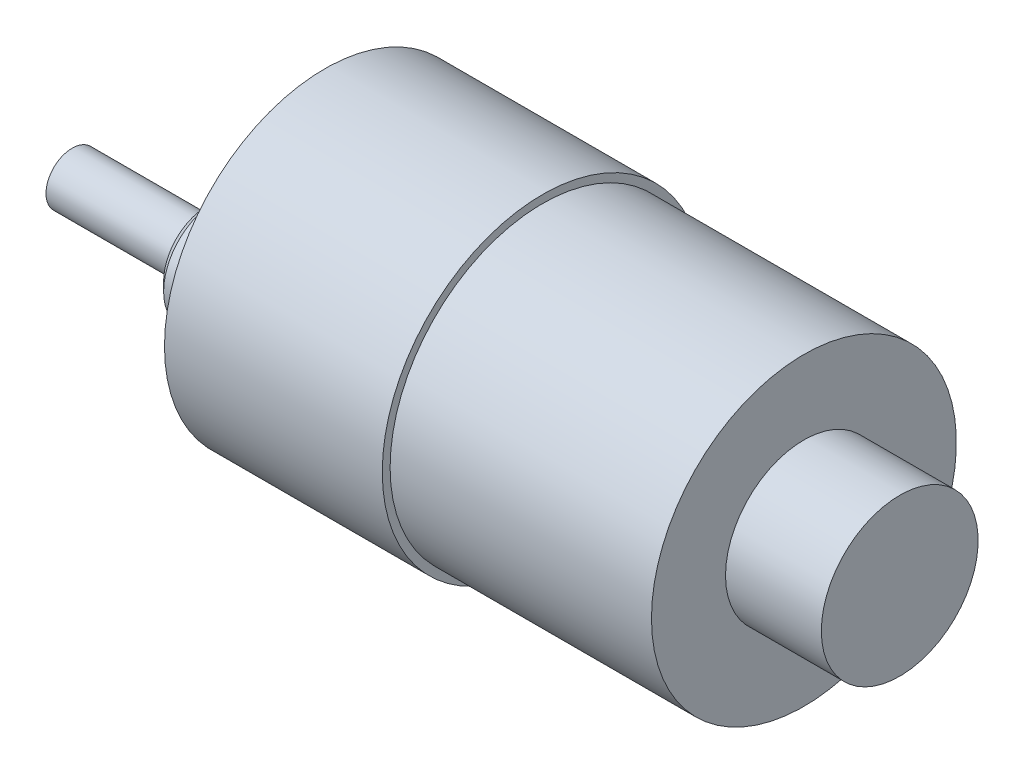
from build123d import *

# Parameters (mm, degrees)
ESQUISSE3_W                                   = 15.5
ESQUISSE3_H                                   = 3
ESQUISSE3_W_2                                 = 6.5
ESQUISSE3_H_2                                 = 6
CHANFREIN1_SIZE                               = 1
ENL_V_MAT_EXTRU_1_DEPTH                       = 82.278041315
ENL_V_MAT_EXTRU_1_DEPTH_BACK                  = 12
TROU_POUR_TARAUDAGE_POUR_TROU_TARAUD_M3_D     = 2.5
TROU_POUR_TARAUDAGE_POUR_TROU_TARAUD_M3_DEPTH = 15
TROU_POUR_TARAUDAGE_POUR_TROU_TARAUD_M3_TIP   = 0.751075774
ESQUISSE9_W                                   = 11
ESQUISSE9_H                                   = 9


with BuildPart() as part:
    # Esquisse1 → Révolution10 (revolve)
    with BuildSketch(Plane.XY, mode=Mode.PRIVATE) as r_volution10_sk:
        Polygon((0, 6), (0, 0), (12.5, 0), (55, 0), (55, 17.5), (25, 17.5), (25, 18.4), (0, 18.4), align=None)
    revolve(r_volution10_sk.sketch.rotate(Axis((12.5, 0, 0), (1, 0, 0)), 90), axis=Axis((12.5, 0, 0), (1, 0, 0)))

    # Esquisse3 → Révolution12 (revolve)
    with BuildSketch(Plane.XY.offset(7), mode=Mode.PRIVATE) as r_volution12_sk:
        with Locations((-14.25, 1.5)):
            Rectangle(ESQUISSE3_W, ESQUISSE3_H)
        with Locations((-3.25, 3)):
            Rectangle(ESQUISSE3_W_2, ESQUISSE3_H_2)
    revolve(r_volution12_sk.sketch.rotate(Axis((0, 0, 7), (1, 0, 0)), 90), axis=Axis((0, 0, 7), (1, 0, 0)))

    # Chanfrein1
    chanfrein1_edges = [part.edges().sort_by_distance(p)[0] for p in [
        (-6.5, 0, 1),
    ]]
    chamfer(chanfrein1_edges, length=CHANFREIN1_SIZE)

    # Esquisse4 → Enlèv. mat.-Extru.1 (cut, two sides: drawn at the far end of the back side and taken through both)
    with BuildSketch(Plane.ZY.offset(22).offset(-ENL_V_MAT_EXTRU_1_DEPTH_BACK)):
        Polygon((-73.282990589, -2.4), (5.2, -2.4), (8.8, -2.4), (87.282990589, -2.4), (87.282990589, -159.365981178), (-73.282990589, -159.365981178), align=None)
    extrude(amount=ENL_V_MAT_EXTRU_1_DEPTH + ENL_V_MAT_EXTRU_1_DEPTH_BACK, mode=Mode.SUBTRACT)

    # Trou pour taraudage pour trou taraudé M3x0.51
    with Locations(Plane.ZY):
        with Locations((0, 15.5), (-13.423393759, -7.75), (0, -15.5), (13.423393759, -7.75), (13.423393759, 7.75), (-13.423393759, 7.75)):
            Hole(TROU_POUR_TARAUDAGE_POUR_TROU_TARAUD_M3_D / 2, depth=TROU_POUR_TARAUDAGE_POUR_TROU_TARAUD_M3_DEPTH)
            with Locations((0, 0, -(TROU_POUR_TARAUDAGE_POUR_TROU_TARAUD_M3_DEPTH + TROU_POUR_TARAUDAGE_POUR_TROU_TARAUD_M3_TIP / 2))):  # 118° drill point
                Cone(0, TROU_POUR_TARAUDAGE_POUR_TROU_TARAUD_M3_D / 2, TROU_POUR_TARAUDAGE_POUR_TROU_TARAUD_M3_TIP, mode=Mode.SUBTRACT)

    # Esquisse9 → Révolution13 (revolve)
    with BuildSketch(Plane.XY, mode=Mode.PRIVATE) as r_volution13_sk:
        with Locations((60.5, 4.5)):
            Rectangle(ESQUISSE9_W, ESQUISSE9_H)
    revolve(r_volution13_sk.sketch.rotate(Axis((0, 0, 0), (1, 0, 0)), 90), axis=Axis((0, 0, 0), (1, 0, 0)))


solid = part.part
